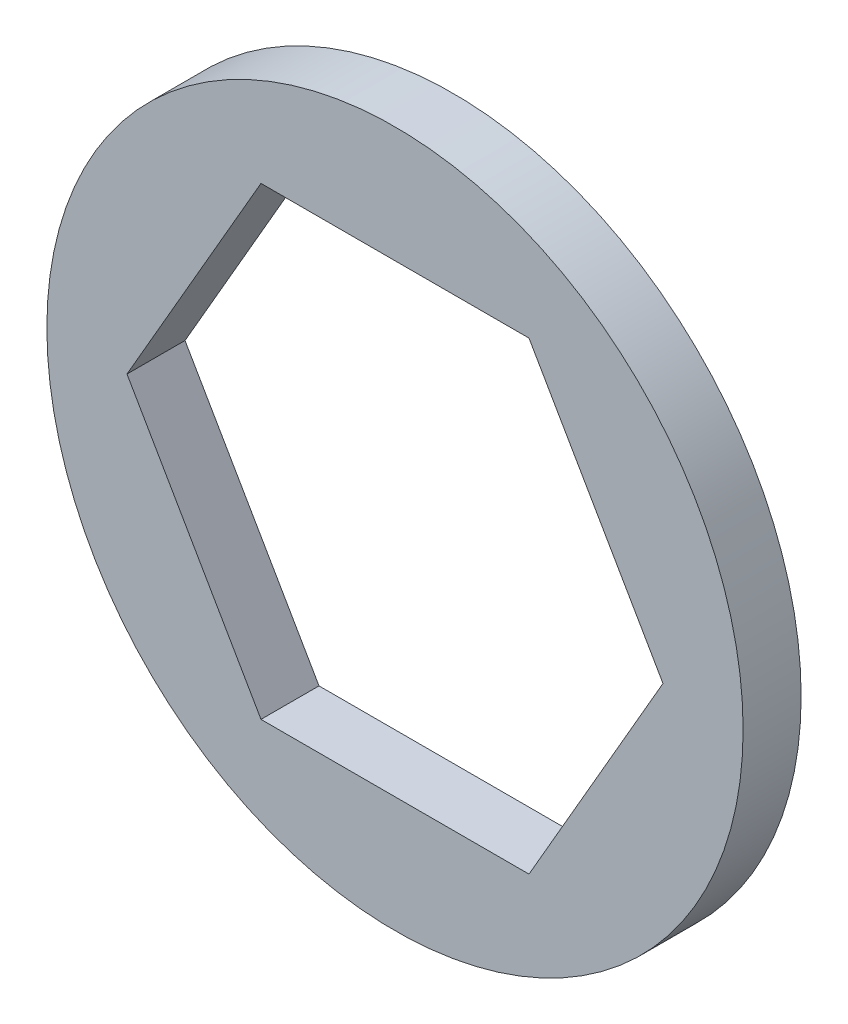
from build123d import *

# Parameters (mm, degrees)
SKETCH1_R           = 9.525
BOSS_EXTRUDE1_DEPTH = 1.5875


with BuildPart() as part:
    # Sketch1 → Boss-Extrude1 (new body)
    with BuildSketch(Plane.XY):
        Circle(SKETCH1_R)
        Polygon((7.332348419, 0), (3.666174209, 6.35), (-3.666174209, 6.35), (-7.332348419, 0), (-3.666174209, -6.35), (3.666174209, -6.35), align=None, mode=Mode.SUBTRACT)
    extrude(amount=BOSS_EXTRUDE1_DEPTH)


solid = part.part
